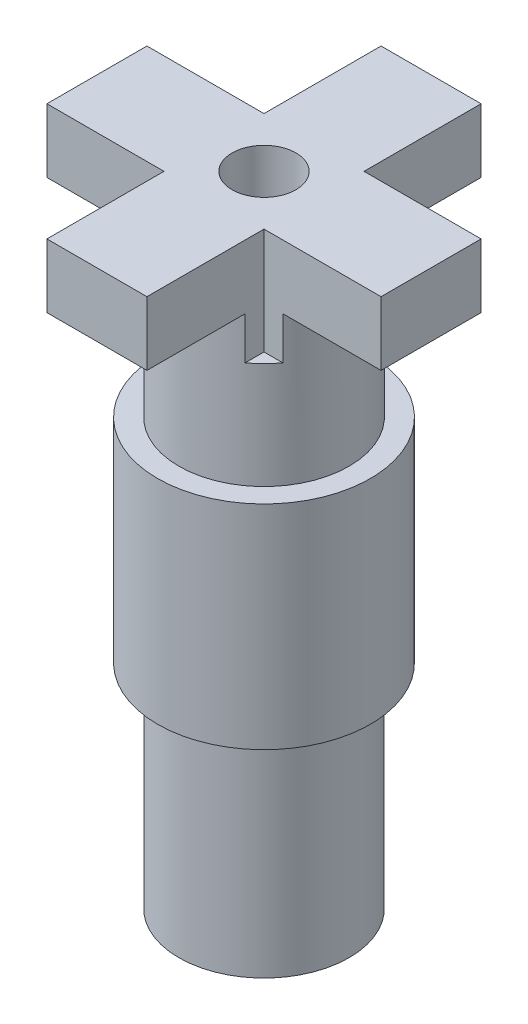
from build123d import *

# Parameters (mm, degrees)
SKETCH_1_R          = 5
EXTRUDE_4_DEPTH     = 10
SKETCH_4_R          = 4
EXTRUDE_5_DEPTH     = 10
EXTRUDE_START       = 10
SKETCH_5_R          = 4
EXTRUDE_6_DEPTH     = 10
EXTRUDE_START_2     = -3
SKETCH_6_W          = 4.7
SKETCH_6_H          = 4.7
EXTRUDE_7_DEPTH     = 3
CUT_EXTRUDE_START   = -5
CUT_EXTRUDE_1_DEPTH = 5
SKETCH_8_R          = 1.5
CUT_EXTRUDE_2_DEPTH = 32.98820095


with BuildPart() as part:
    # 草图1 → 凸台-拉伸4 (new body)
    with BuildSketch(Plane(origin=(0, 0, 0), x_dir=(1, 0, 0), z_dir=(0, 1, 0))):
        with Locations(Location((0, 0, 0), (0, 0, 270))):
            Circle(SKETCH_1_R)
    extrude(amount=EXTRUDE_4_DEPTH)

    # 草图4 → 凸台-拉伸5 (add)
    with BuildSketch(Plane(origin=(0, 10, 0), x_dir=(1, 0, 0), z_dir=(0, 1, 0))):
        with Locations(Location((0, 0, 0), (0, 0, 270))):
            Circle(SKETCH_4_R)
    extrude(amount=EXTRUDE_5_DEPTH)

    # 草图5 → 凸台-拉伸6 (add)
    with BuildSketch(Plane.XZ.offset(EXTRUDE_START)):
        with Locations(Location((0, 0, 0), (0, 0, 90))):
            Circle(SKETCH_5_R)
    extrude(amount=-EXTRUDE_6_DEPTH)

    # 草图6 → 凸台-拉伸7 (add)
    with BuildSketch(Plane(origin=(0, 20, 0), x_dir=(1, 0, 0), z_dir=(0, 1, 0)).offset(EXTRUDE_START_2)):
        with BuildLine():
            Line((-7.85, 2.35), (-7.85, -2.35))
            Line((-7.85, -2.35), (-3.236896662, -2.35))
            ThreePointArc((-3.236896662, -2.35), (-4, 0), (-3.236896662, 2.35))
            Line((-3.236896662, 2.35), (-7.85, 2.35))
        make_face()
        with BuildLine():
            Line((-2.35, 7.85), (-2.35, 3.236896662))
            ThreePointArc((-2.35, 3.236896662), (0, 4), (2.35, 3.236896662))
            Line((2.35, 3.236896662), (2.35, 7.85))
            Line((2.35, 7.85), (-2.35, 7.85))
        make_face()
        with BuildLine():
            ThreePointArc((4, 0), (3.804443892, -1.235397376), (3.236896662, -2.35))
            Line((3.236896662, -2.35), (7.85, -2.35))
            Line((7.85, -2.35), (7.85, 2.35))
            Line((7.85, 2.35), (3.236896662, 2.35))
            ThreePointArc((3.236896662, 2.35), (3.804443892, 1.235397376), (4, 0))
        make_face()
        with BuildLine():
            ThreePointArc((2.35, -3.236896662), (0, -4), (-2.35, -3.236896662))
            Line((-2.35, -3.236896662), (-2.35, -7.85))
            Line((-2.35, -7.85), (2.35, -7.85))
            Line((2.35, -7.85), (2.35, -3.236896662))
        make_face()
        with BuildLine():
            Line((2.35, -2.35), (-2.35, -2.35))
            Line((-2.35, -2.35), (-2.35, -3.236896662))
            ThreePointArc((-2.35, -3.236896662), (0, -4), (2.35, -3.236896662))
            Line((2.35, -3.236896662), (2.35, -2.35))
        make_face()
        with BuildLine():
            Line((2.35, 2.35), (2.35, -2.35))
            Line((2.35, -2.35), (3.236896662, -2.35))
            ThreePointArc((3.236896662, -2.35), (3.804443892, -1.235397376), (4, 0))
            ThreePointArc((4, 0), (3.804443892, 1.235397376), (3.236896662, 2.35))
            Line((3.236896662, 2.35), (2.35, 2.35))
        make_face()
        with BuildLine():
            Line((-2.35, 3.236896662), (-2.35, 2.35))
            Line((-2.35, 2.35), (2.35, 2.35))
            Line((2.35, 2.35), (2.35, 3.236896662))
            ThreePointArc((2.35, 3.236896662), (0, 4), (-2.35, 3.236896662))
        make_face()
        with BuildLine():
            ThreePointArc((-3.236896662, 2.35), (-4, 0), (-3.236896662, -2.35))
            Line((-3.236896662, -2.35), (-2.35, -2.35))
            Line((-2.35, -2.35), (-2.35, 2.35))
            Line((-2.35, 2.35), (-3.236896662, 2.35))
        make_face()
        Rectangle(SKETCH_6_W, SKETCH_6_H)
    extrude(amount=EXTRUDE_7_DEPTH)

    # 草图7 → 切除-拉伸1 (cut)
    with BuildSketch(Plane(origin=(0, 20, 0), x_dir=(1, 0, 0), z_dir=(0, 1, 0)).offset(CUT_EXTRUDE_START)):
        with BuildLine():
            Line((-2.35, -2.35), (-3.236896662, -2.35))
            ThreePointArc((-3.236896662, -2.35), (-2.828427125, -2.828427125), (-2.35, -3.236896662))
            Line((-2.35, -3.236896662), (-2.35, -2.35))
        make_face()
        with BuildLine():
            Line((3.236896662, -2.35), (2.35, -2.35))
            Line((2.35, -2.35), (2.35, -3.236896662))
            ThreePointArc((2.35, -3.236896662), (2.828427125, -2.828427125), (3.236896662, -2.35))
        make_face()
        with BuildLine():
            Line((2.35, 3.236896662), (2.35, 2.35))
            Line((2.35, 2.35), (3.236896662, 2.35))
            ThreePointArc((3.236896662, 2.35), (2.828427125, 2.828427125), (2.35, 3.236896662))
        make_face()
        with BuildLine():
            ThreePointArc((-2.35, 3.236896662), (-2.828427125, 2.828427125), (-3.236896662, 2.35))
            Line((-3.236896662, 2.35), (-2.35, 2.35))
            Line((-2.35, 2.35), (-2.35, 3.236896662))
        make_face()
    extrude(amount=CUT_EXTRUDE_1_DEPTH, mode=Mode.SUBTRACT)

    # 草图8 → 切除-拉伸2 (cut, through all)
    with BuildSketch(Plane(origin=(0, 20, 0), x_dir=(1, 0, 0), z_dir=(0, 1, 0))):
        with Locations(Location((0, 0, 0), (0, 0, 270))):
            Circle(SKETCH_8_R)
    extrude(amount=-CUT_EXTRUDE_2_DEPTH, mode=Mode.SUBTRACT)


solid = part.part
